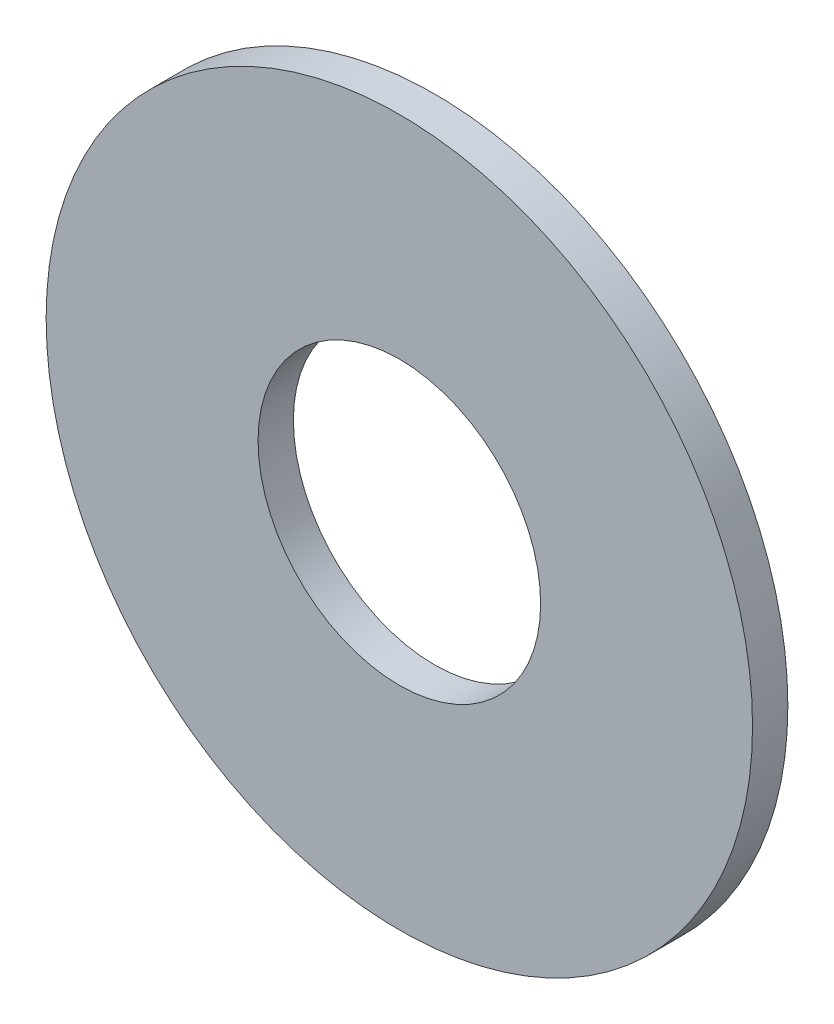
from build123d import *

# Parameters (mm, degrees)
SKETCH_1_R      = 5
SKETCH_1_R_2    = 2
EXTRUDE_1_DEPTH = 0.5


with BuildPart() as part:
    # 草图1 → 凸台-拉伸1 (new body)
    with BuildSketch(Plane.XY):
        Circle(SKETCH_1_R)
        Circle(SKETCH_1_R_2, mode=Mode.SUBTRACT)
    extrude(amount=EXTRUDE_1_DEPTH)


solid = part.part
